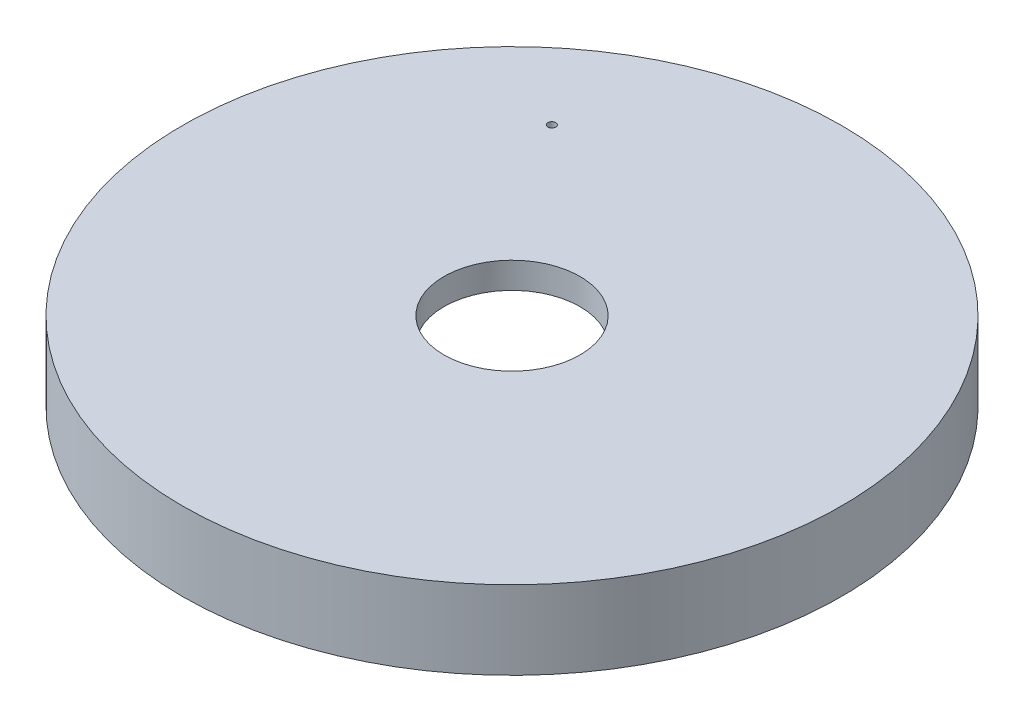
from build123d import *

# Parameters (mm, degrees)
SZKIC2_R                   = 0.75
WYTNIJ_WYCI_GNI_CIE2_DEPTH = 15


with BuildPart() as part:
    # Szkic1 → Obrót1 (revolve)
    with BuildSketch(Plane.XY, mode=Mode.PRIVATE) as obr_t1_sk:
        Polygon((13, 2.5), (63, 2.5), (63, -12.5), (40.474774195, -12.5), (13, -2.5), align=None)
    revolve(obr_t1_sk.sketch.rotate(Axis((0, 24.608336301, 0), (0, -1, 0)), 90), axis=Axis((0, 24.608336301, 0), (0, -1, 0)))

    # Szkic2 → Wytnij-wyciągnięcie2 (cut, symmetric)
    with BuildSketch(Plane(origin=(0, 0, 0), x_dir=(1, 0, 0), z_dir=(0, 1, 0))):
        with Locations(Location((-27.785960816, 35.396897909, 0), (0, 0, 270))):
            Circle(SZKIC2_R)
    extrude(amount=WYTNIJ_WYCI_GNI_CIE2_DEPTH, both=True, mode=Mode.SUBTRACT)


solid = part.part
